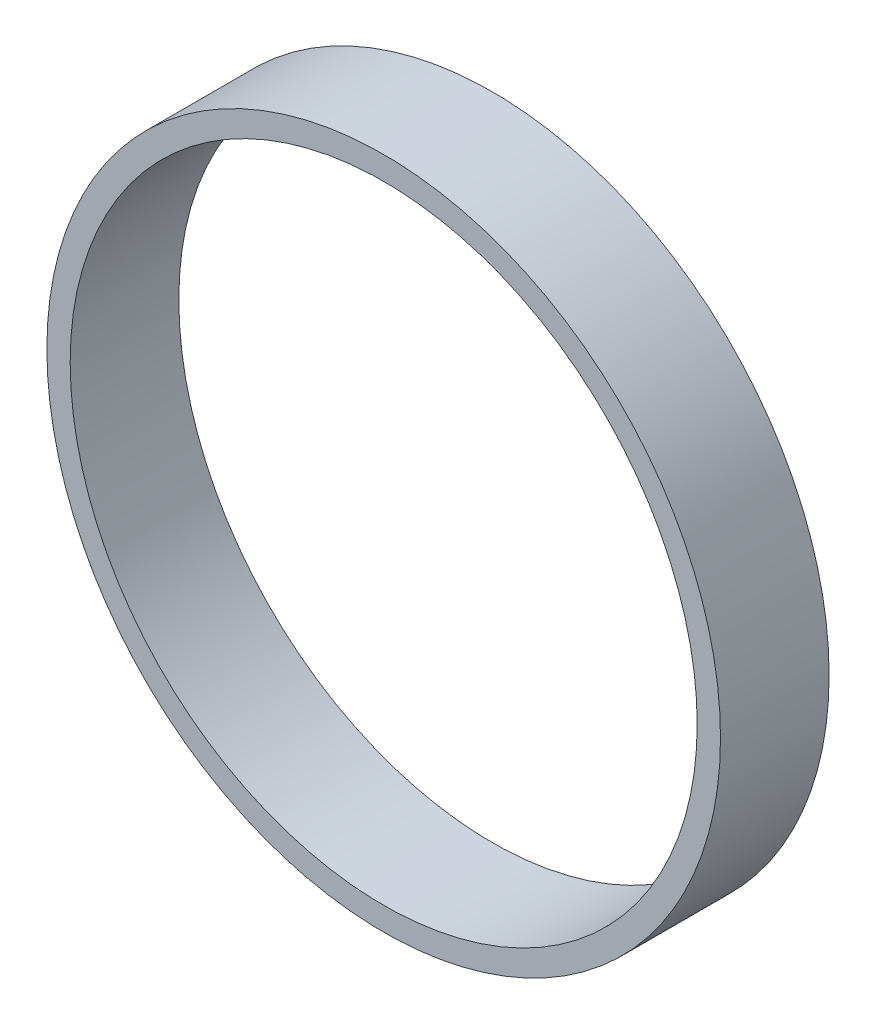
from build123d import *

# Parameters (mm, degrees)
SKETCH1_R           = 34.11
SKETCH1_R_2         = 31.75
BOSS_EXTRUDE1_DEPTH = 11


with BuildPart() as part:
    # Sketch1 → Boss-Extrude1 (new body)
    with BuildSketch(Plane.XY):
        Circle(SKETCH1_R)
        Circle(SKETCH1_R_2, mode=Mode.SUBTRACT)
    extrude(amount=BOSS_EXTRUDE1_DEPTH)


solid = part.part
